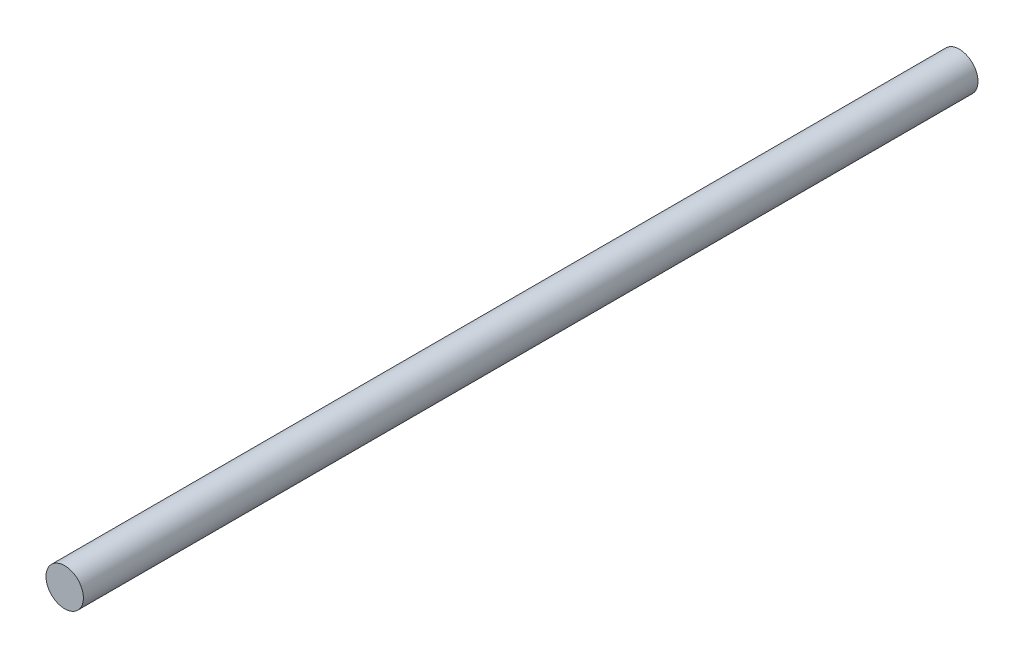
from build123d import *

# Parameters (mm, degrees)
SKETCH1_R           = 6.35
BOSS_EXTRUDE1_DEPTH = 303.53


with BuildPart() as part:
    # Sketch1 → Boss-Extrude1 (new body)
    with BuildSketch(Plane.XY):
        Circle(SKETCH1_R)
    extrude(amount=-BOSS_EXTRUDE1_DEPTH)


solid = part.part
